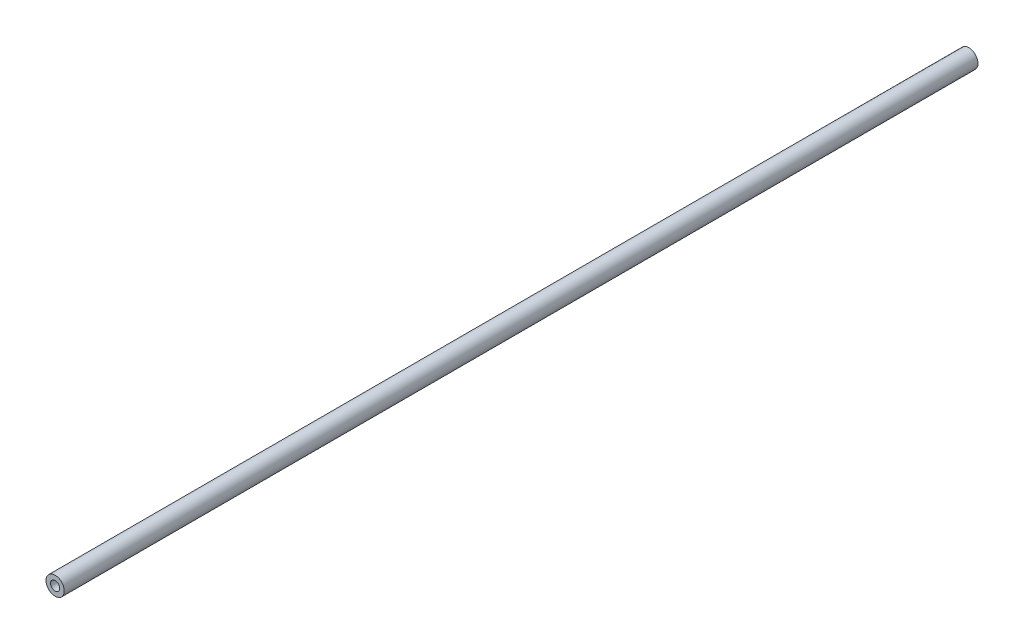
from build123d import *

# Parameters (mm, degrees)
SKIZZE1_R                       = 2
SKIZZE1_R_2                     = 1
AUFSATZ_LINEAR_AUSTRAGEN1_DEPTH = 200


with BuildPart() as part:
    # Skizze1 → Aufsatz-Linear austragen1 (new body)
    with BuildSketch(Plane.XY):
        Circle(SKIZZE1_R)
        Circle(SKIZZE1_R_2, mode=Mode.SUBTRACT)
    extrude(amount=AUFSATZ_LINEAR_AUSTRAGEN1_DEPTH)


solid = part.part
